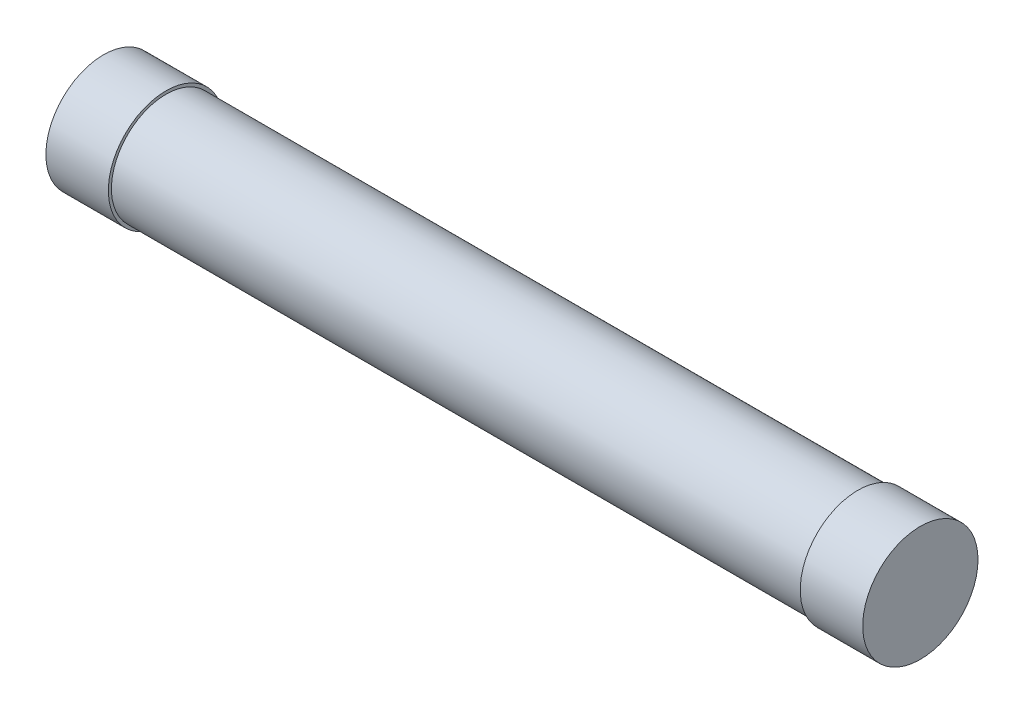
from build123d import *

# Parameters (mm, degrees)
SKETCH1_R           = 9.525
BOSS_EXTRUDE1_DEPTH = 67.46875
SKETCH2_R           = 9.525
SKETCH2_R_2         = 9.025
CUT_EXTRUDE1_DEPTH  = 57.15


with BuildPart() as part:
    # Sketch1 → Boss-Extrude1 (new, symmetric)
    with BuildSketch(Plane(origin=(0, 0, 0), x_dir=(0, 0, -1), z_dir=(1, 0, 0))):
        Circle(SKETCH1_R)
    extrude(amount=BOSS_EXTRUDE1_DEPTH, both=True)

    # Sketch2 → Cut-Extrude1 (cut, symmetric)
    with BuildSketch(Plane(origin=(0, 0, 0), x_dir=(0, 0, -1), z_dir=(1, 0, 0))):
        Circle(SKETCH2_R)
        Circle(SKETCH2_R_2, mode=Mode.SUBTRACT)
    extrude(amount=CUT_EXTRUDE1_DEPTH, both=True, mode=Mode.SUBTRACT)


solid = part.part
